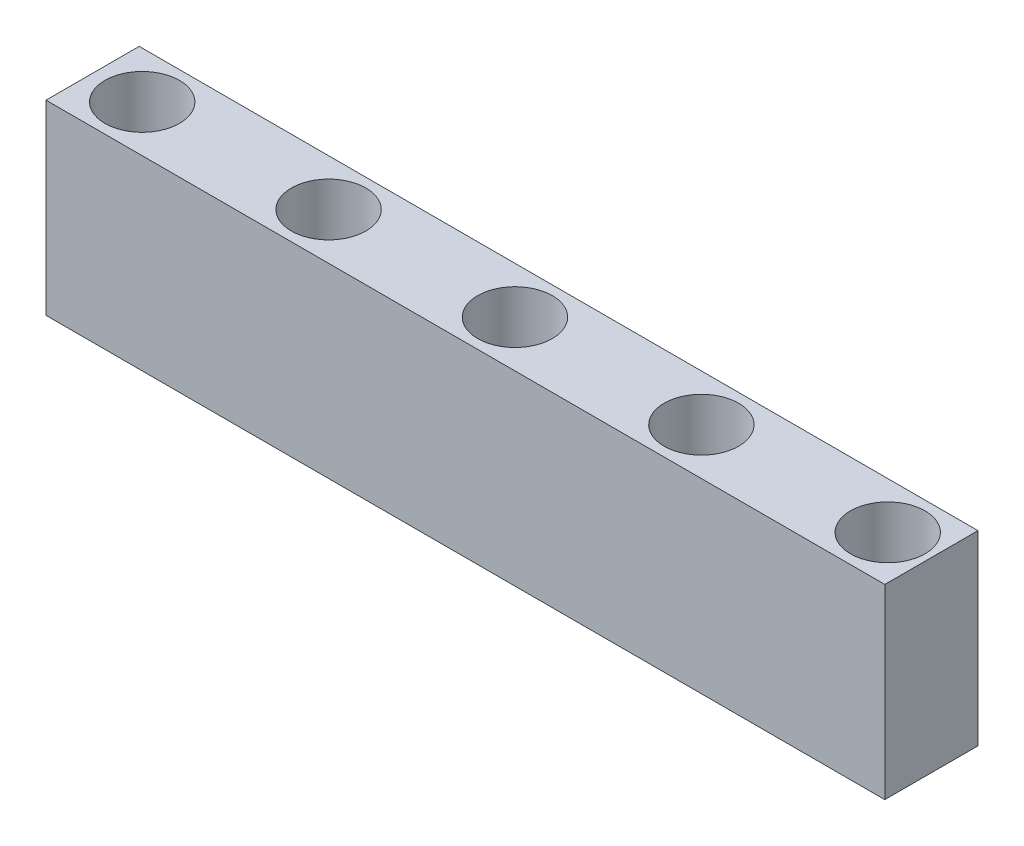
from build123d import *

# Parameters (mm, degrees)
SKETCH_1_W          = 50
SKETCH_1_H          = 5
SKETCH_1_R          = 2
EXTRUDE_1_DEPTH     = 10
SKETCH_2_W          = 4.996058956
SKETCH_2_H          = 5
CUT_EXTRUDE_1_DEPTH = 10


with BuildPart() as part:
    # 草图1 → 凸台-拉伸1 (new body)
    with BuildSketch(Plane(origin=(0, 0, 0), x_dir=(1, 0, 0), z_dir=(0, 1, 0))):
        with Locations((-15, 0)):
            Rectangle(SKETCH_1_W, SKETCH_1_H)
        with Locations(Location((-37.33819922, 0, 0), (0, 0, 270))):
            Circle(SKETCH_1_R, mode=Mode.SUBTRACT)
        with Locations(Location((-27.33819922, 0, 0), (0, 0, 270))):
            Circle(SKETCH_1_R, mode=Mode.SUBTRACT)
        with Locations(Location((-17.33819922, 0, 0), (0, 0, 270))):
            Circle(SKETCH_1_R, mode=Mode.SUBTRACT)
        with Locations(Location((-7.33819922, 0, 0), (0, 0, 270))):
            Circle(SKETCH_1_R, mode=Mode.SUBTRACT)
        with Locations(Location((2.66180078, 0, 0), (0, 0, 270))):
            Circle(SKETCH_1_R, mode=Mode.SUBTRACT)
    extrude(amount=EXTRUDE_1_DEPTH)

    # 草图2 → 切除-拉伸1 (cut)
    with BuildSketch(Plane(origin=(0, 10, 0), x_dir=(1, 0, 0), z_dir=(0, 1, 0))):
        with Locations((7.501970522, 0)):
            Rectangle(SKETCH_2_W, SKETCH_2_H)
    extrude(amount=-CUT_EXTRUDE_1_DEPTH, mode=Mode.SUBTRACT)


solid = part.part
